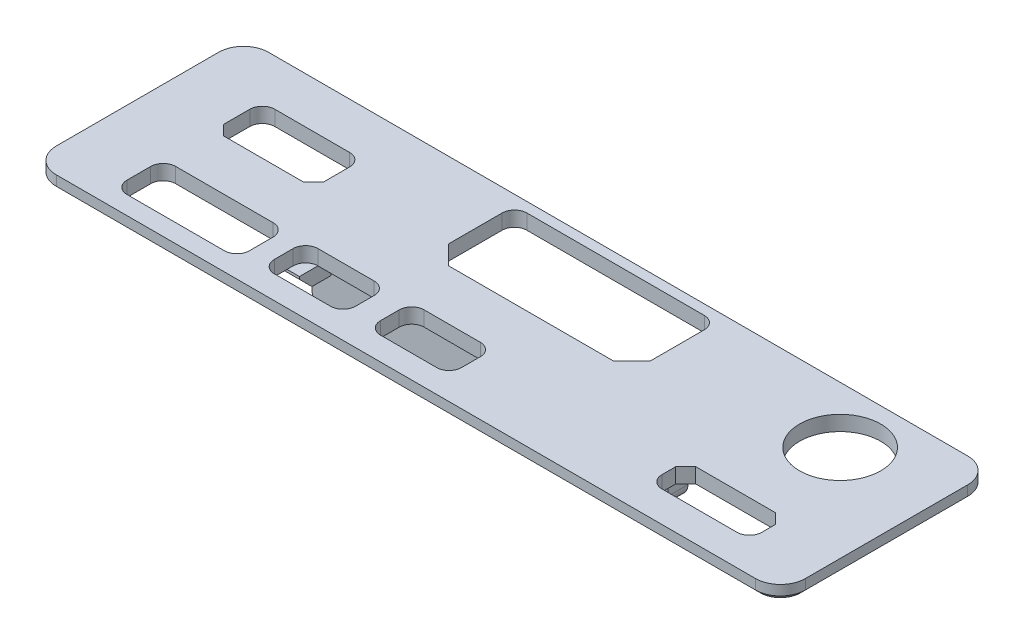
from build123d import *

# Parameters (mm, degrees)
SKETCH_1_W          = 60
SKETCH_1_H          = 17
EXTRUDE_1_DEPTH     = 1.2
CUT_EXTRUDE_1_REACH = 33.204
SKETCH_4_R          = 3.25
SKETCH_4_W          = 8
SKETCH_4_H          = 3.9
SKETCH_4_W_2        = 16.2
SKETCH_4_H_2        = 6.8
SKETCH_4_H_3        = 2.9
SKETCH_4_W_3        = 6.5
SKETCH_4_H_4        = 3.5
SKETCH_4_W_4        = 9.8
FILLET_2_R          = 1
CHAMFER_1_SIZE      = 0.8
SKETCH_5_W          = 1.5
SKETCH_5_H          = 8
EXTRUDE_2_DEPTH     = 1.2
SKETCH_6_W          = 28.5
SKETCH_6_H          = 1.6
EXTRUDE_3_DEPTH     = 4
FILLET_3_R          = 1
CHAMFER_2_SIZE      = 1
FILLET_4_R          = 2
CHAMFER_5_SIZE      = 0.4
CHAMFER_6_SIZE      = 1.5


with BuildPart() as part:
    # 草图1 → 凸台-拉伸1 (new body)
    with BuildSketch(Plane(origin=(0, 0, 0), x_dir=(1, 0, 0), z_dir=(0, 1, 0))):
        Rectangle(SKETCH_1_W, SKETCH_1_H)
    extrude(amount=EXTRUDE_1_DEPTH)

    # 草图4 → 切除-拉伸1 (cut, up to next)
    with BuildSketch(Plane(origin=(0, 1.2, 0), x_dir=(1, 0, 0), z_dir=(0, 1, 0)), mode=Mode.PRIVATE) as cut_extrude_1_sk1:
        with Locations(Location((22.298485985, 3.98318929, 0), (0, 0, 270))):
            Circle(SKETCH_4_R)
    cut_extrude_1_tool1 = extrude(cut_extrude_1_sk1.sketch, amount=-CUT_EXTRUDE_1_REACH, mode=Mode.PRIVATE) & part.part
    # 草图4 → 切除-拉伸1 (cut, up to next)
    with BuildSketch(Plane(origin=(0, 1.2, 0), x_dir=(1, 0, 0), z_dir=(0, 1, 0)), mode=Mode.PRIVATE) as cut_extrude_1_sk2:
        with Locations((-20.8, 2.85)):
            Rectangle(SKETCH_4_W, SKETCH_4_H)
    cut_extrude_1_tool2 = extrude(cut_extrude_1_sk2.sketch, amount=-CUT_EXTRUDE_1_REACH, mode=Mode.PRIVATE) & part.part
    # 草图4 → 切除-拉伸1 (cut, up to next)
    with BuildSketch(Plane(origin=(0, 1.2, 0), x_dir=(1, 0, 0), z_dir=(0, 1, 0)), mode=Mode.PRIVATE) as cut_extrude_1_sk3:
        with Locations((0.6, 4.3)):
            Rectangle(SKETCH_4_W_2, SKETCH_4_H_2)
    cut_extrude_1_tool3 = extrude(cut_extrude_1_sk3.sketch, amount=-CUT_EXTRUDE_1_REACH, mode=Mode.PRIVATE) & part.part
    # 草图4 → 切除-拉伸1 (cut, up to next)
    with BuildSketch(Plane(origin=(0, 1.2, 0), x_dir=(1, 0, 0), z_dir=(0, 1, 0)), mode=Mode.PRIVATE) as cut_extrude_1_sk4:
        with Locations((21.05, -4.584803861)):
            Rectangle(SKETCH_4_W, SKETCH_4_H_3)
    cut_extrude_1_tool4 = extrude(cut_extrude_1_sk4.sketch, amount=-CUT_EXTRUDE_1_REACH, mode=Mode.PRIVATE) & part.part
    # 草图4 → 切除-拉伸1 (cut, up to next)
    with BuildSketch(Plane(origin=(0, 1.2, 0), x_dir=(1, 0, 0), z_dir=(0, 1, 0)), mode=Mode.PRIVATE) as cut_extrude_1_sk5:
        with Locations((-1.65, -4.884803861)):
            Rectangle(SKETCH_4_W_3, SKETCH_4_H_4)
    cut_extrude_1_tool5 = extrude(cut_extrude_1_sk5.sketch, amount=-CUT_EXTRUDE_1_REACH, mode=Mode.PRIVATE) & part.part
    # 草图4 → 切除-拉伸1 (cut, up to next)
    with BuildSketch(Plane(origin=(0, 1.2, 0), x_dir=(1, 0, 0), z_dir=(0, 1, 0)), mode=Mode.PRIVATE) as cut_extrude_1_sk6:
        with Locations((-10.15, -4.884803861)):
            Rectangle(SKETCH_4_W_3, SKETCH_4_H_4)
    cut_extrude_1_tool6 = extrude(cut_extrude_1_sk6.sketch, amount=-CUT_EXTRUDE_1_REACH, mode=Mode.PRIVATE) & part.part
    # 草图4 → 切除-拉伸1 (cut, up to next)
    with BuildSketch(Plane(origin=(0, 1.2, 0), x_dir=(1, 0, 0), z_dir=(0, 1, 0)), mode=Mode.PRIVATE) as cut_extrude_1_sk7:
        with Locations((-19.9, -5.084803861)):
            Rectangle(SKETCH_4_W_4, SKETCH_4_H)
    cut_extrude_1_tool7 = extrude(cut_extrude_1_sk7.sketch, amount=-CUT_EXTRUDE_1_REACH, mode=Mode.PRIVATE) & part.part
    add(cut_extrude_1_tool1.solids().sort_by_distance((22.298486, 1.2, -3.983189))[0], mode=Mode.SUBTRACT)
    add(cut_extrude_1_tool2.solids().sort_by_distance((-20.8, 1.2, -2.85))[0], mode=Mode.SUBTRACT)
    add(cut_extrude_1_tool3.solids().sort_by_distance((0.6, 1.2, -4.3))[0], mode=Mode.SUBTRACT)
    add(cut_extrude_1_tool4.solids().sort_by_distance((21.05, 1.2, 4.584804))[0], mode=Mode.SUBTRACT)
    add(cut_extrude_1_tool5.solids().sort_by_distance((-1.65, 1.2, 4.884804))[0], mode=Mode.SUBTRACT)
    add(cut_extrude_1_tool6.solids().sort_by_distance((-10.15, 1.2, 4.884804))[0], mode=Mode.SUBTRACT)
    add(cut_extrude_1_tool7.solids().sort_by_distance((-19.9, 1.2, 5.084804))[0], mode=Mode.SUBTRACT)

    # 圆角2
    fillet_2_edges = [part.edges().sort_by_distance(p)[0] for p in [
        (-13.4, 0.6, 6.634803861),
        (-13.4, 0.6, 3.134803861),
        (-6.9, 0.6, 3.134803861),
        (-6.9, 0.6, 6.634803861),
        (-4.9, 0.6, 6.634803861),
        (-4.9, 0.6, 3.134803861),
        (1.6, 0.6, 3.134803861),
        (1.6, 0.6, 6.634803861),
        (17.05, 0.6, 6.034803861),
        (25.05, 0.6, 6.034803861),
        (-7.5, 0.6, -7.7),
        (8.7, 0.6, -7.7),
        (-24.8, 0.6, 7.034803861),
        (-24.8, 0.6, 3.134803861),
        (-15, 0.6, 3.134803861),
        (-15, 0.6, 7.034803861),
        (-24.8, 0.6, -4.8),
        (-16.8, 0.6, -4.8),
    ]]
    fillet(fillet_2_edges, radius=FILLET_2_R)

    # 倒角1
    chamfer_1_edges = [part.edges().sort_by_distance(p)[0] for p in [
        (17.05, 0.6, 3.134803861),
        (25.05, 0.6, 3.134803861),
        (-24.8, 0.6, -0.9),
        (-16.8, 0.6, -0.9),
    ]]
    chamfer(chamfer_1_edges, length=CHAMFER_1_SIZE)

    # 草图5 → 凸台-拉伸2 (add)
    with BuildSketch(Plane.XZ):
        with Locations((-13.15891381, 0.61681071)):
            Rectangle(SKETCH_5_W, SKETCH_5_H)
        with Locations((13.84108619, 0.61681071)):
            Rectangle(SKETCH_5_W, SKETCH_5_H)
    extrude(amount=EXTRUDE_2_DEPTH)

    # 草图6 → 凸台-拉伸3 (add)
    with BuildSketch(Plane.XZ):
        with Locations((0.34108619, 1.3)):
            Rectangle(SKETCH_6_W, SKETCH_6_H)
    extrude(amount=EXTRUDE_3_DEPTH)

    # 圆角3
    fillet_3_edges = [part.edges().sort_by_distance(p)[0] for p in [
        (-13.90891381, -4, 1.3),
        (14.59108619, -4, 1.3),
    ]]
    fillet(fillet_3_edges, radius=FILLET_3_R)

    # 倒角2
    chamfer_2_edges = [part.edges().sort_by_distance(p)[0] for p in [
        (-13.15891381, -1.2, -3.38318929),
        (-13.15891381, -1.2, 4.61681071),
        (13.84108619, -1.2, -3.38318929),
        (13.84108619, -1.2, 4.61681071),
    ]]
    chamfer(chamfer_2_edges, length=CHAMFER_2_SIZE)

    # 圆角4
    fillet_4_edges = [part.edges().sort_by_distance(p)[0] for p in [
        (30, 0.6, 8.5),
        (-30, 0.6, 8.5),
        (-30, 0.6, -8.5),
        (30, 0.6, -8.5),
    ]]
    fillet(fillet_4_edges, radius=FILLET_4_R)

    # 倒角5
    chamfer_5_edges = [part.edges().sort_by_distance(p)[0] for p in [
        (30, 0, 0),
        (0, 0, 8.5),
        (-30, 0, 0),
        (0, 0, -8.5),
        (-29.414213562, 0, -7.914213562),
        (-29.414213562, 0, 7.914213562),
        (29.414213562, 0, -7.914213562),
        (29.414213562, 0, 7.914213562),
    ]]
    chamfer(chamfer_5_edges, length=CHAMFER_5_SIZE)

    # 倒角6
    chamfer_6_edges = [part.edges().sort_by_distance(p)[0] for p in [
        (-7.5, 0.6, -0.9),
        (8.7, 0.6, -0.9),
    ]]
    chamfer(chamfer_6_edges, length=CHAMFER_6_SIZE)


solid = part.part
